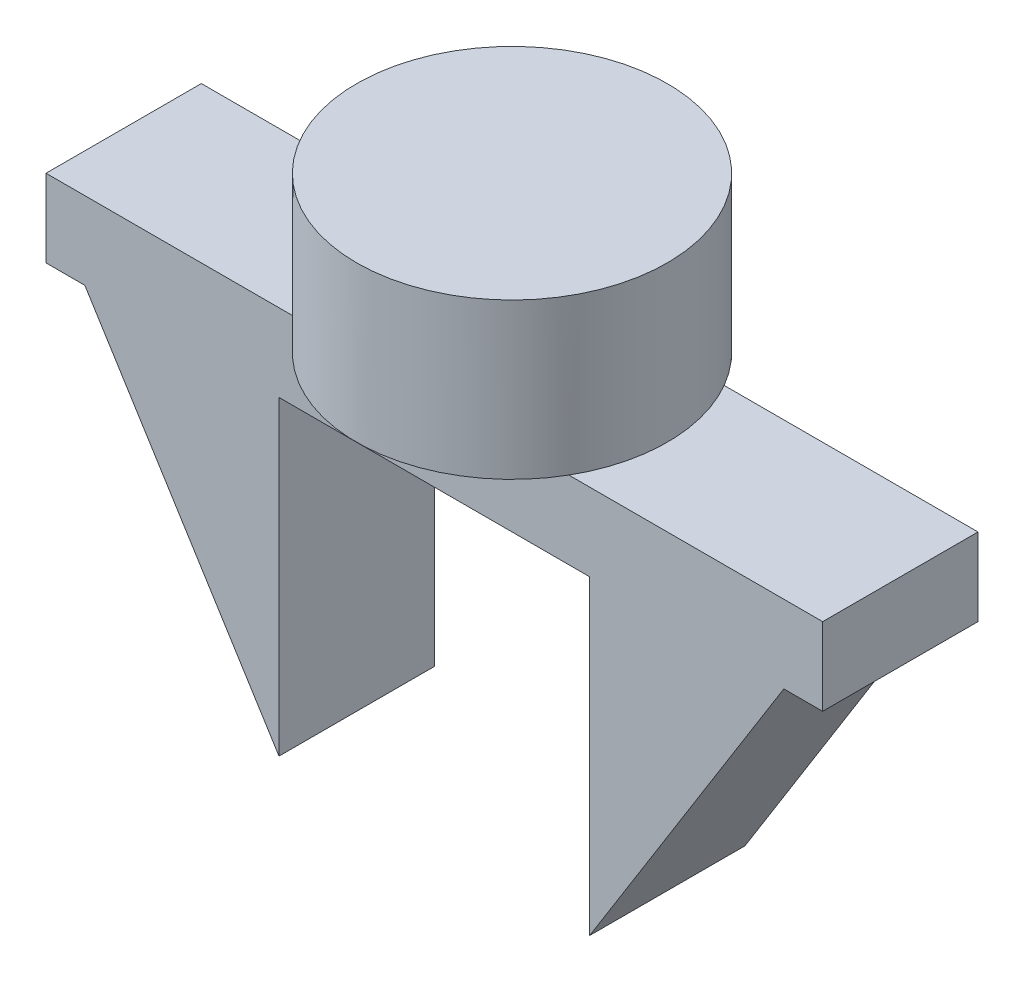
from build123d import *

# Parameters (mm, degrees)
EXTRUDE_1_DEPTH = 20
SKETCH_3_R      = 20
EXTRUDE_2_DEPTH = 20


with BuildPart() as part:
    # 草图2 → 凸台-拉伸1 (new body)
    with BuildSketch(Plane.XY):
        Polygon((50, 0), (-50, 0), (-50, -10), (-45, -10), (-20, -50), (-20, -10), (20, -10), (20, -50), (45, -10), (50, -10), align=None)
    extrude(amount=EXTRUDE_1_DEPTH)

    # 草图3 → 凸台-拉伸2 (add)
    with BuildSketch(Plane(origin=(0, 0, 0), x_dir=(1, 0, 0), z_dir=(0, 1, 0))):
        with Locations(Location((0, -10, 0), (0, 0, 30))):
            Circle(SKETCH_3_R)
    extrude(amount=EXTRUDE_2_DEPTH)


solid = part.part
